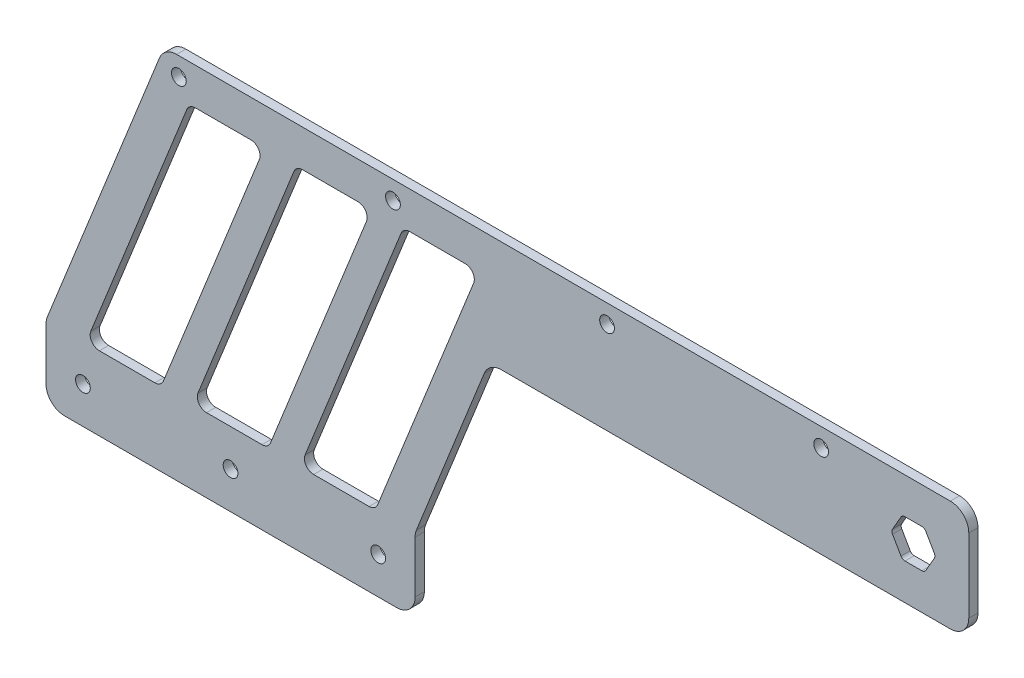
from build123d import *

# Parameters (mm, degrees)
SKETCH1_R           = 2.54
BOSS_EXTRUDE1_DEPTH = 3.175
FILLET1_R           = 6.35
CUT_EXTRUDE1_DEPTH  = 342.972704503
FILLET2_R           = 3.175
SKETCH3_R           = 2.54
CUT_EXTRUDE2_DEPTH  = 342.972704503
FILLET3_R           = 1.5875


with BuildPart() as part:
    # Sketch1 → Boss-Extrude1 (new body)
    with BuildSketch(Plane.XY):
        Polygon((0, 25.4), (0, 0), (127, 0), (127, 25.4), (152.4, 88.9), (317.5, 88.9), (317.5, 127), (279.4, 127), (152.4, 127), (40.64, 127), align=None)
        with Locations((12.7, 12.7)):
            Circle(SKETCH1_R, mode=Mode.SUBTRACT)
        with Locations((63.5, 12.7)):
            Circle(SKETCH1_R, mode=Mode.SUBTRACT)
        with Locations((114.3, 12.7)):
            Circle(SKETCH1_R, mode=Mode.SUBTRACT)
        Polygon((302.262821178, 101.346), (306.075642355, 107.95), (302.262821178, 114.554), (294.637178822, 114.554), (290.824357645, 107.95), (294.637178822, 101.346), align=None, mode=Mode.SUBTRACT)
    extrude(amount=BOSS_EXTRUDE1_DEPTH)

    # Fillet1
    fillet1_edges = [part.edges().sort_by_distance(p)[0] for p in [
        (40.64, 127, 1.5875),
        (317.5, 127, 1.5875),
        (317.5, 88.9, 1.5875),
        (152.4, 88.9, 1.5875),
        (127, 25.4, 1.5875),
        (127, 0, 1.5875),
        (0, 0, 1.5875),
        (0, 25.4, 1.5875),
    ]]
    fillet(fillet1_edges, radius=FILLET1_R)

    # Sketch2 → Cut-Extrude1 (cut, through all)
    with BuildSketch(Plane.XY.offset(3.175)):
        Polygon((49.23831861, 114.3), (13.67831861, 25.4), (39.597669611, 25.4), (75.157669611, 114.3), align=None)
        Polygon((86.100324499, 114.3), (50.540324499, 25.4), (76.459675501, 25.4), (112.019675501, 114.3), align=None)
        Polygon((122.962330389, 114.3), (87.402330389, 25.4), (113.32168139, 25.4), (148.88168139, 114.3), align=None)
    extrude(amount=-CUT_EXTRUDE1_DEPTH, mode=Mode.SUBTRACT)

    # Fillet2
    fillet2_edges = [part.edges().sort_by_distance(p)[0] for p in [
        (76.459675501, 25.4, 1.5875),
        (50.540324499, 25.4, 1.5875),
        (86.100324499, 114.3, 1.5875),
        (112.019675501, 114.3, 1.5875),
        (148.88168139, 114.3, 1.5875),
        (113.32168139, 25.4, 1.5875),
        (87.402330389, 25.4, 1.5875),
        (122.962330389, 114.3, 1.5875),
        (39.597669611, 25.4, 1.5875),
        (13.67831861, 25.4, 1.5875),
        (49.23831861, 114.3, 1.5875),
        (75.157669611, 114.3, 1.5875),
    ]]
    fillet(fillet2_edges, radius=FILLET2_R)

    # Sketch3 → Cut-Extrude2 (cut, through all)
    with BuildSketch(Plane.XY.offset(3.175)):
        with Locations((45.72, 120.65)):
            Circle(SKETCH3_R)
        with Locations((119.38, 120.65)):
            Circle(SKETCH3_R)
        with Locations((193.04, 120.65)):
            Circle(SKETCH3_R)
        with Locations((266.7, 120.65)):
            Circle(SKETCH3_R)
    extrude(amount=-CUT_EXTRUDE2_DEPTH, mode=Mode.SUBTRACT)

    # Fillet3
    fillet3_edges = [part.edges().sort_by_distance(p)[0] for p in [
        (294.637178822, 101.346, 1.5875),
        (302.262821178, 101.346, 1.5875),
        (306.075642355, 107.95, 1.5875),
        (302.262821178, 114.554, 1.5875),
        (294.637178822, 114.554, 1.5875),
        (290.824357645, 107.95, 1.5875),
    ]]
    fillet(fillet3_edges, radius=FILLET3_R)


solid = part.part
